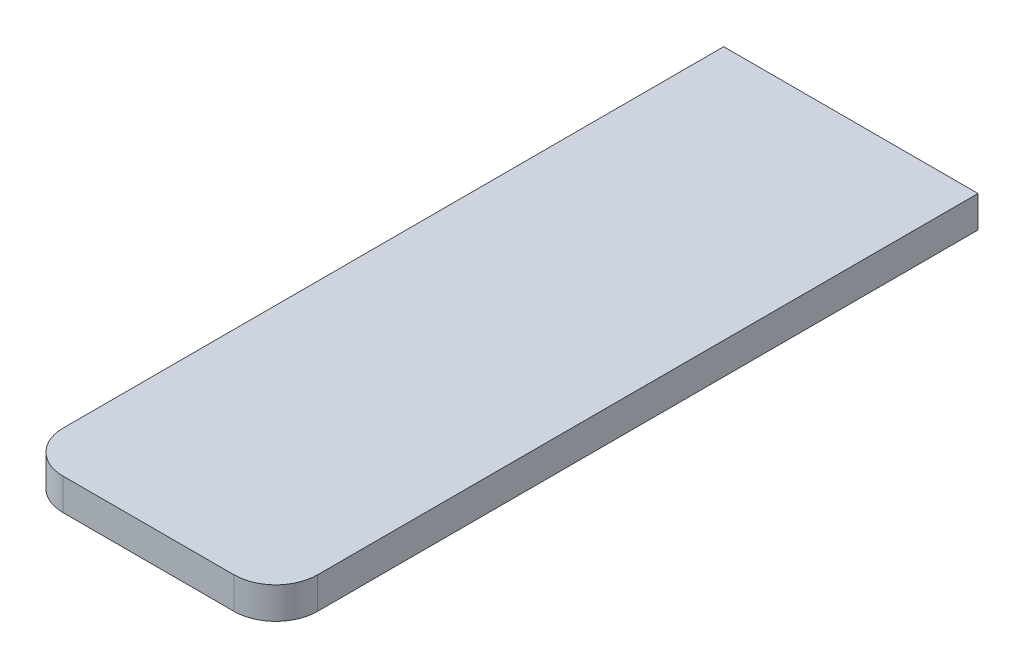
from build123d import *

# Parameters (mm, degrees)
SKETCH2_W           = 24.1
SKETCH2_H           = 62.6
BOSS_EXTRUDE3_DEPTH = 3
SKETCH3_W           = 24.1
SKETCH3_H           = 3.95
BOSS_EXTRUDE4_DEPTH = 3
FILLET1_R           = 3.95
FILLET2_R           = 3.95


with BuildPart() as part:
    # Sketch2 → Boss-Extrude3 (new body)
    with BuildSketch(Plane(origin=(0, 0, 0), x_dir=(1, 0, 0), z_dir=(0, 1, 0))):
        Rectangle(SKETCH2_W, SKETCH2_H)
    extrude(amount=BOSS_EXTRUDE3_DEPTH)

    # Sketch3 → Boss-Extrude4 (add)
    with BuildSketch(Plane(origin=(0, 3, 0), x_dir=(1, 0, 0), z_dir=(0, 1, 0))):
        with Locations((0, -33.275)):
            Rectangle(SKETCH3_W, SKETCH3_H)
    extrude(amount=-BOSS_EXTRUDE4_DEPTH)

    # Fillet1
    fillet1_edges = [part.edges().sort_by_distance(p)[0] for p in [
        (12.05, 1.5, 35.25),
    ]]
    fillet(fillet1_edges, radius=FILLET1_R)

    # Fillet2
    fillet2_edges = [part.edges().sort_by_distance(p)[0] for p in [
        (-12.05, 1.5, 35.25),
    ]]
    fillet(fillet2_edges, radius=FILLET2_R)


solid = part.part
